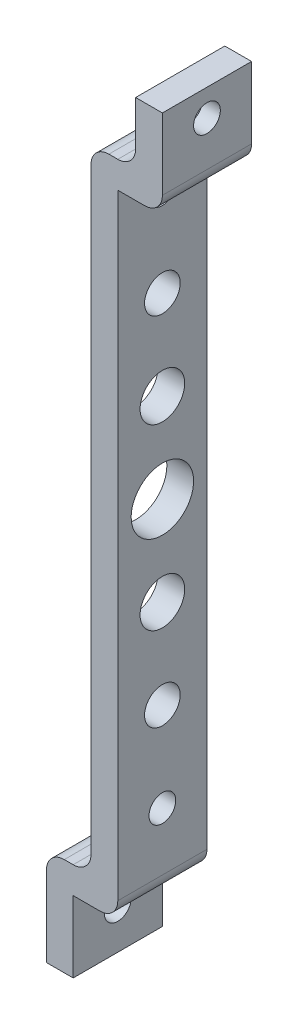
from build123d import *

# Parameters (mm, degrees)
Y_KSEKLIK_EKSTR_ZYON1_DEPTH = 10
IZIM2_W                     = 3
IZIM2_H                     = 10
Y_KSEKLIK_EKSTR_ZYON2_DEPTH = 1
IZIM3_W                     = 3
IZIM3_H                     = 10
Y_KSEKLIK_EKSTR_ZYON3_DEPTH = 1
IZIM4_R                     = 1.5
KES_EKSTR_ZYON1_DEPTH       = 4
PAH1_SIZE                   = 1
IZIM5_R                     = 1.5
KES_EKSTR_ZYON2_DEPTH       = 4
PAH2_SIZE                   = 1
RADYUS1_R                   = 2
IZIM6_R                     = 3.5
IZIM6_R_2                   = 2.5
IZIM6_R_3                   = 2
IZIM6_R_4                   = 1.5
KES_EKSTR_ZYON3_DEPTH       = 4


with BuildPart() as part:
    # Çizim1 → Yükseklik-Ekstrüzyon1 (new body)
    with BuildSketch(Plane.XY):
        Polygon((10, 87), (10, 81), (5, 81), (5, 10), (0, 10), (0, 0), (3, 0), (3, 7), (8, 7), (8, 78), (13, 78), (13, 87), align=None)
    extrude(amount=Y_KSEKLIK_EKSTR_ZYON1_DEPTH)

    # Çizim2 → Yükseklik-Ekstrüzyon2 (add)
    with BuildSketch(Plane(origin=(0, 87, 0), x_dir=(1, 0, 0), z_dir=(0, 1, 0))):
        with Locations((11.5, -5)):
            Rectangle(IZIM2_W, IZIM2_H)
    extrude(amount=Y_KSEKLIK_EKSTR_ZYON2_DEPTH)

    # Çizim3 → Yükseklik-Ekstrüzyon3 (add)
    with BuildSketch(Plane.XZ):
        with Locations((1.5, 5)):
            Rectangle(IZIM3_W, IZIM3_H)
    extrude(amount=Y_KSEKLIK_EKSTR_ZYON3_DEPTH)

    # Çizim4 → Kes-Ekstrüzyon1 (cut)
    with BuildSketch(Plane.ZY.offset(-10)):
        with Locations(Location((5, 85, 0), (0, 0, 270))):
            Circle(IZIM4_R)
    extrude(amount=-KES_EKSTR_ZYON1_DEPTH, mode=Mode.SUBTRACT)

    # Pah1
    pah1_edges = [part.edges().sort_by_distance(p)[0] for p in [
        (10, 86.5, 5),
    ]]
    chamfer(pah1_edges, length=PAH1_SIZE)

    # Çizim5 → Kes-Ekstrüzyon2 (cut)
    with BuildSketch(Plane.ZY):
        with Locations(Location((5, 3.5, 0), (0, 0, 270))):
            Circle(IZIM5_R)
    extrude(amount=-KES_EKSTR_ZYON2_DEPTH, mode=Mode.SUBTRACT)

    # Pah2
    pah2_edges = [part.edges().sort_by_distance(p)[0] for p in [
        (0, 5, 5),
    ]]
    chamfer(pah2_edges, length=PAH2_SIZE)

    # Radyus1
    radyus1_edges = [part.edges().sort_by_distance(p)[0] for p in [
        (13, 78, 5),
        (8, 7, 5),
        (0, 10, 5),
        (5, 10, 5),
        (5, 81, 5),
        (10, 81, 5),
    ]]
    fillet(radyus1_edges, radius=RADYUS1_R)

    # Çizim6 → Kes-Ekstrüzyon3 (cut)
    with BuildSketch(Plane.ZY.offset(-5)):
        with Locations(Location((5, 45.5, 0), (0, 0, 270))):
            Circle(IZIM6_R)
        with Locations(Location((5, 55.5, 0), (0, 0, 270))):
            Circle(IZIM6_R_2)
        with Locations(Location((5, 65.5, 0), (0, 0, 270))):
            Circle(IZIM6_R_3)
        with Locations(Location((5, 75.5, 0), (0, 0, 270))):
            Circle(IZIM6_R_4)
        with Locations(Location((5, 15.5, 0), (0, 0, 270))):
            Circle(IZIM6_R_4)
        with Locations(Location((5, 25.5, 0), (0, 0, 270))):
            Circle(IZIM6_R_3)
        with Locations(Location((5, 35.5, 0), (0, 0, 270))):
            Circle(IZIM6_R_2)
    extrude(amount=-KES_EKSTR_ZYON3_DEPTH, mode=Mode.SUBTRACT)


solid = part.part
